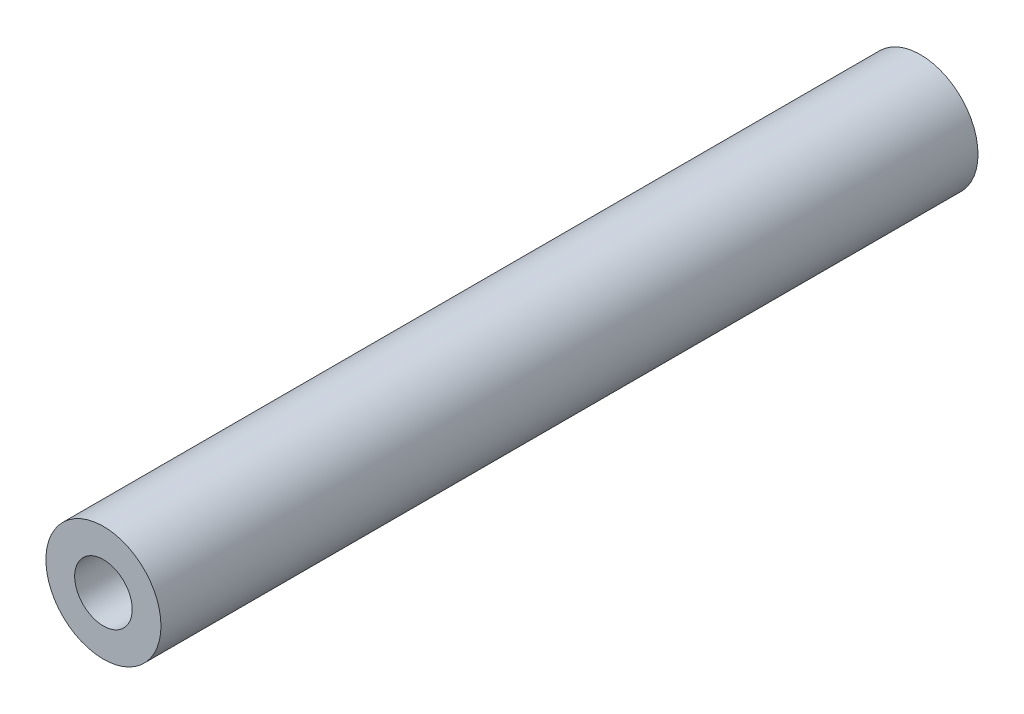
from build123d import *

# Parameters (mm, degrees)
SKETCH_1_R      = 5
SKETCH_1_R_2    = 2.5
EXTRUDE_1_DEPTH = 71


with BuildPart() as part:
    # 草图1 → 凸台-拉伸1 (new body)
    with BuildSketch(Plane.XY):
        Circle(SKETCH_1_R)
        Circle(SKETCH_1_R_2, mode=Mode.SUBTRACT)
    extrude(amount=EXTRUDE_1_DEPTH)


solid = part.part
